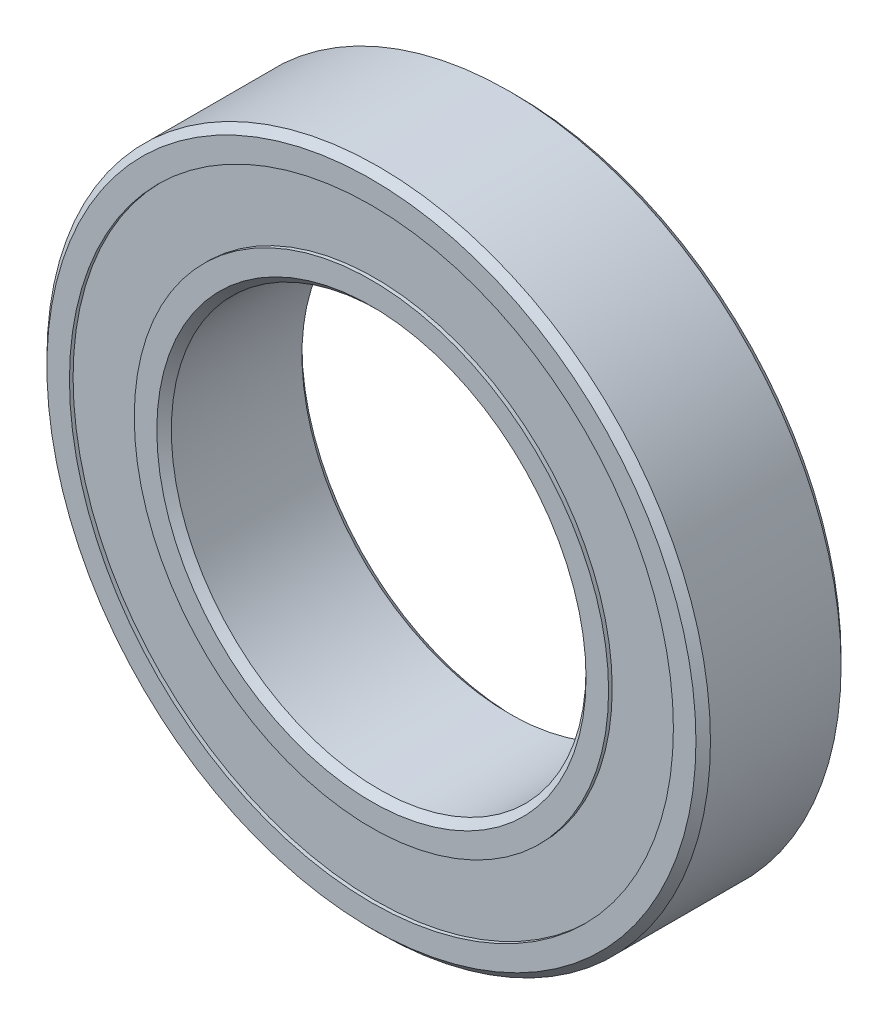
from build123d import *

# Parameters (mm, degrees)
CIRPATTERN1_COUNT = 11
SKETCH5_W         = 1.120196304
SKETCH5_H         = 3.125


with BuildPart() as part:
    # Sketch3 → Revolve1 (revolve)
    with BuildSketch(Plane(origin=(0, 0, 0), x_dir=(0, 0, -1), z_dir=(1, 0, 0)), mode=Mode.PRIVATE) as revolve1_sk:
        with BuildLine():
            Line((-3.5, 15.65), (-3.5, 14.5625))
            Line((-3.5, 14.5625), (-1.555555556, 14.5625))
            ThreePointArc((-1.555555556, 14.5625), (0, 15.204803696), (1.555555556, 14.5625))
            Line((1.555555556, 14.5625), (3.5, 14.5625))
            Line((3.5, 14.5625), (3.5, 15.65))
            Line((3.5, 15.65), (3.15, 16))
            Line((3.15, 16), (-3.15, 16))
            Line((-3.15, 16), (-3.5, 15.65))
        make_face()
        with BuildLine():
            Line((-3.5, 10.35), (-3.5, 11.4375))
            Line((-3.5, 11.4375), (-1.555555556, 11.4375))
            ThreePointArc((-1.555555556, 11.4375), (0, 10.795196304), (1.555555556, 11.4375))
            Line((1.555555556, 11.4375), (3.5, 11.4375))
            Line((3.5, 11.4375), (3.5, 10.35))
            Line((3.5, 10.35), (3.15, 10))
            Line((3.15, 10), (-3.15, 10))
            Line((-3.15, 10), (-3.5, 10.35))
        make_face()
    revolve(revolve1_sk.sketch.rotate(Axis((0, 0, 3.5), (0, 0, -1)), 90), axis=Axis((0, 0, 3.5), (0, 0, -1)))


with BuildPart() as body_2:
    # Sketch4 → Revolve2 (revolve)
    with BuildSketch(Plane(origin=(0, 0, 0), x_dir=(0, 0, -1), z_dir=(1, 0, 0))):
        with BuildLine():
            Line((-2.204803696, 13), (2.204803696, 13))
            ThreePointArc((2.204803696, 13), (0, 15.204803696), (-2.204803696, 13))
        make_face()
    revolve(axis=Axis((0, 13, 2.204803696), (0, 0, -1)))


with BuildPart() as cirpattern1_1:
    # CirPattern1: pattern copy
    add(body_2.part.rotate(Axis((0, 0, 0), (0, 0, 1)), 1 * 360 / CIRPATTERN1_COUNT))


with BuildPart() as cirpattern1_2:
    # CirPattern1: pattern copy
    add(body_2.part.rotate(Axis((0, 0, 0), (0, 0, 1)), 2 * 360 / CIRPATTERN1_COUNT))


with BuildPart() as cirpattern1_3:
    # CirPattern1: pattern copy
    add(body_2.part.rotate(Axis((0, 0, 0), (0, 0, 1)), 3 * 360 / CIRPATTERN1_COUNT))


with BuildPart() as cirpattern1_4:
    # CirPattern1: pattern copy
    add(body_2.part.rotate(Axis((0, 0, 0), (0, 0, 1)), 4 * 360 / CIRPATTERN1_COUNT))


with BuildPart() as cirpattern1_5:
    # CirPattern1: pattern copy
    add(body_2.part.rotate(Axis((0, 0, 0), (0, 0, 1)), 5 * 360 / CIRPATTERN1_COUNT))


with BuildPart() as cirpattern1_6:
    # CirPattern1: pattern copy
    add(body_2.part.rotate(Axis((0, 0, 0), (0, 0, 1)), 6 * 360 / CIRPATTERN1_COUNT))


with BuildPart() as cirpattern1_7:
    # CirPattern1: pattern copy
    add(body_2.part.rotate(Axis((0, 0, 0), (0, 0, 1)), 7 * 360 / CIRPATTERN1_COUNT))


with BuildPart() as cirpattern1_8:
    # CirPattern1: pattern copy
    add(body_2.part.rotate(Axis((0, 0, 0), (0, 0, 1)), 8 * 360 / CIRPATTERN1_COUNT))


with BuildPart() as cirpattern1_9:
    # CirPattern1: pattern copy
    add(body_2.part.rotate(Axis((0, 0, 0), (0, 0, 1)), 9 * 360 / CIRPATTERN1_COUNT))


with BuildPart() as cirpattern1_10:
    # CirPattern1: pattern copy
    add(body_2.part.rotate(Axis((0, 0, 0), (0, 0, 1)), 10 * 360 / CIRPATTERN1_COUNT))


with BuildPart() as body_13:
    # Sketch5 → Revolve3 (revolve)
    with BuildSketch(Plane(origin=(0, 0, 0), x_dir=(0, 0, -1), z_dir=(1, 0, 0)), mode=Mode.PRIVATE) as revolve3_sk:
        with Locations((-2.764901848, 13)):
            Rectangle(SKETCH5_W, SKETCH5_H)
        with Locations((2.764901848, 13)):
            Rectangle(SKETCH5_W, SKETCH5_H)
    revolve(revolve3_sk.sketch.rotate(Axis((0, 0, 3.5), (0, 0, -1)), 90), axis=Axis((0, 0, 3.5), (0, 0, -1)))


solid = Compound([part.part, body_2.part, cirpattern1_1.part, cirpattern1_2.part, cirpattern1_3.part, cirpattern1_4.part, cirpattern1_5.part, cirpattern1_6.part, cirpattern1_7.part, cirpattern1_8.part, cirpattern1_9.part, cirpattern1_10.part, body_13.part])
